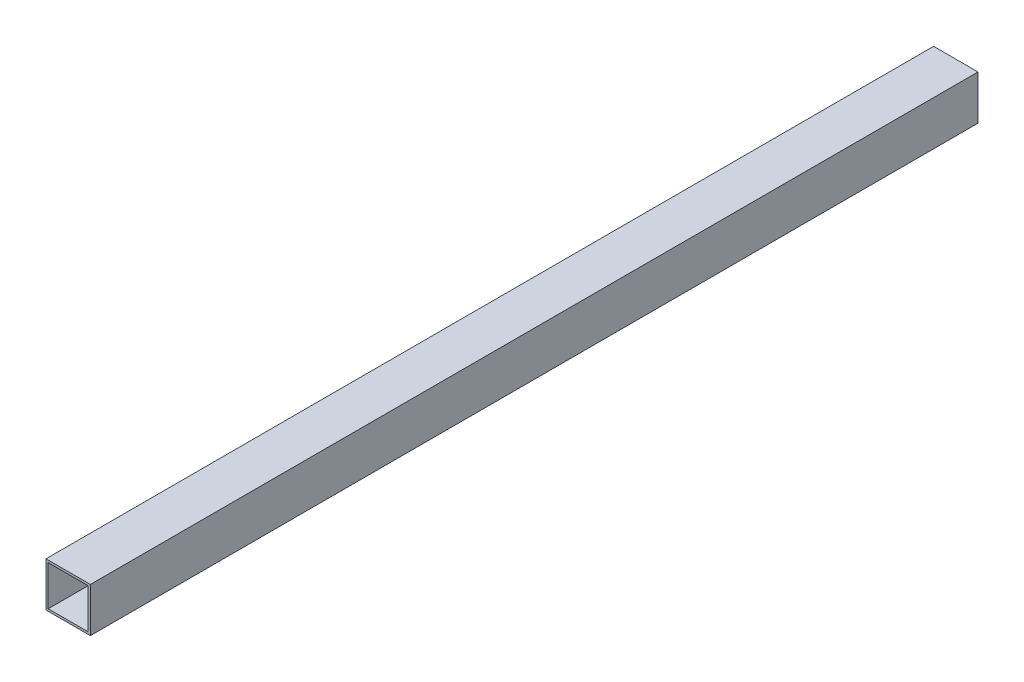
from build123d import *

# Parameters (mm, degrees)
SKETCH3_W           = 20
SKETCH3_H           = 20
SKETCH3_W_2         = 18
SKETCH3_H_2         = 18
BOSS_EXTRUDE1_DEPTH = 400


with BuildPart() as part:
    # Sketch3 → Boss-Extrude1 (new body)
    with BuildSketch(Plane.XY):
        Rectangle(SKETCH3_W, SKETCH3_H)
        Rectangle(SKETCH3_W_2, SKETCH3_H_2, mode=Mode.SUBTRACT)
    extrude(amount=BOSS_EXTRUDE1_DEPTH)


solid = part.part
